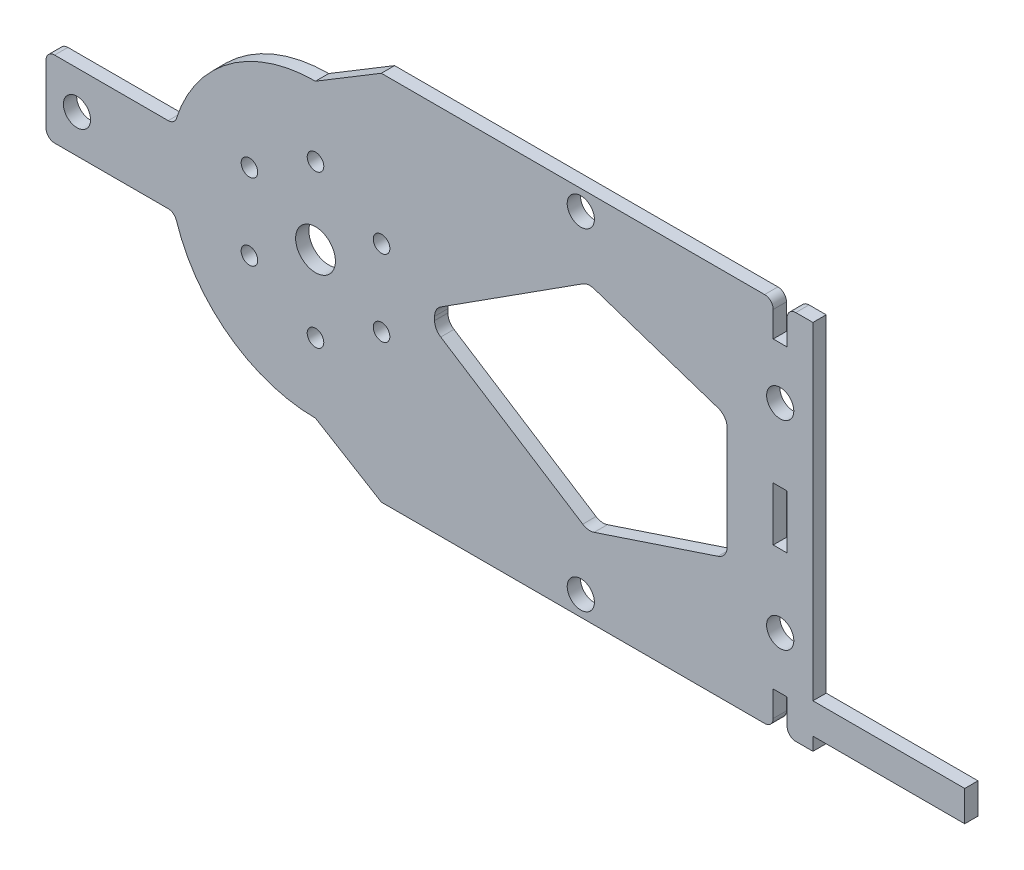
from build123d import *

# Parameters (mm, degrees)
SKETCH_1_R      = 2.05
SKETCH_1_R_2    = 3
SKETCH_1_R_3    = 1.25
SKETCH_1_W      = 2.1
SKETCH_1_H      = 8.1
EXTRUDE_1_DEPTH = 2
FILLET_1_R      = 1.3
FILLET_2_R      = 2


with BuildPart() as part:
    # 草图1 → 凸台-拉伸1 (new body)
    with BuildSketch(Plane.XY):
        with BuildLine():
            Line((32.115707856, 28), (32.115707856, 22.85))
            Line((32.115707856, 22.85), (30.015707856, 22.85))
            Line((30.015707856, 22.85), (30.015707856, 28))
            Line((30.015707856, 28), (-29.075, 28))
            Line((-29.075, 28), (-38.998995168, 22.002009663))
            ThreePointArc((-38.998995168, 22.002009663), (-52.370174504, 17.472835843), (-60.236366221, 5.75))
            Line((-60.236366221, 5.75), (-79.631279411, 5.75))
            Line((-79.631279411, 5.75), (-79.631279411, -5.75))
            Line((-79.631279411, -5.75), (-60.236366221, -5.75))
            ThreePointArc((-60.236366221, -5.75), (-52.370174504, -17.472835843), (-38.998995168, -22.002009663))
            Line((-38.998995168, -22.002009663), (-29.075, -28))
            Line((-29.075, -28), (30.015707856, -28))
            Line((30.015707856, -28), (30.015707856, -22.85))
            Line((30.015707856, -22.85), (32.115707856, -22.85))
            Line((32.115707856, -22.85), (32.115707856, -28))
            Line((32.115707856, -28), (36.001004832, -28))
            Line((36.001004832, -28), (36.001004832, -26.017733681))
            Line((36.001004832, -26.017733681), (58.888331717, -26.017733681))
            Line((58.888331717, -26.017733681), (58.888331717, -21.401911511))
            Line((58.888331717, -21.401911511), (36.001004832, -21.401911511))
            Line((36.001004832, -21.401911511), (36.001004832, 28))
            Line((36.001004832, 28), (32.115707856, 28))
        make_face()
        with Locations((31.065707856, 15)):
            Circle(SKETCH_1_R, mode=Mode.SUBTRACT)
        with Locations(Location((31.065707856, -15, 0), (0, 0, 180))):
            Circle(SKETCH_1_R, mode=Mode.SUBTRACT)
        with Locations((-38.998995168, 0)):
            Circle(SKETCH_1_R_2, mode=Mode.SUBTRACT)
        with Locations((-38.998995168, -11.5)):
            Circle(SKETCH_1_R_3, mode=Mode.SUBTRACT)
        with Locations((-48.958287312, -5.75)):
            Circle(SKETCH_1_R_3, mode=Mode.SUBTRACT)
        with Locations((-48.958287312, 5.75)):
            Circle(SKETCH_1_R_3, mode=Mode.SUBTRACT)
        with Locations((-38.998995168, 11.5)):
            Circle(SKETCH_1_R_3, mode=Mode.SUBTRACT)
        with Locations((-29.039703025, 5.75)):
            Circle(SKETCH_1_R_3, mode=Mode.SUBTRACT)
        with Locations((-29.039703025, -5.75)):
            Circle(SKETCH_1_R_3, mode=Mode.SUBTRACT)
        with Locations((1.001004832, -25)):
            Circle(SKETCH_1_R, mode=Mode.SUBTRACT)
        with Locations((1.001004832, 25)):
            Circle(SKETCH_1_R, mode=Mode.SUBTRACT)
        with Locations((-74.958287312, 0)):
            Circle(SKETCH_1_R, mode=Mode.SUBTRACT)
        with Locations((31.065707856, 0)):
            Rectangle(SKETCH_1_W, SKETCH_1_H, mode=Mode.SUBTRACT)
        Polygon((2.100885183, -16.20323489), (23.065707856, -9.230000311), (23.065707856, 9.230000311), (2.100885183, 16.20323489), (-21.039703025, 1.3748119), (-21.039703025, -1.3748119), align=None, mode=Mode.SUBTRACT)
    extrude(amount=EXTRUDE_1_DEPTH)

    # 圆角1
    fillet_1_edges = [part.edges().sort_by_distance(p)[0] for p in [
        (-60.236366221, -5.75, 1),
        (-79.631279411, -5.75, 1),
        (-79.631279411, 5.75, 1),
        (-60.236366221, 5.75, 1),
        (30.015707856, 28, 1),
        (32.115707856, 28, 1),
        (32.115707856, -28, 1),
        (30.015707856, -28, 1),
    ]]
    fillet(fillet_1_edges, radius=FILLET_1_R)

    # 圆角2
    fillet_2_edges = [part.edges().sort_by_distance(p)[0] for p in [
        (-21.039703025, -1.3748119, 1),
        (2.100885183, -16.20323489, 1),
        (23.065707856, -9.230000311, 1),
        (23.065707856, 9.230000311, 1),
        (2.100885183, 16.20323489, 1),
        (-21.039703025, 1.3748119, 1),
    ]]
    fillet(fillet_2_edges, radius=FILLET_2_R)


solid = part.part
